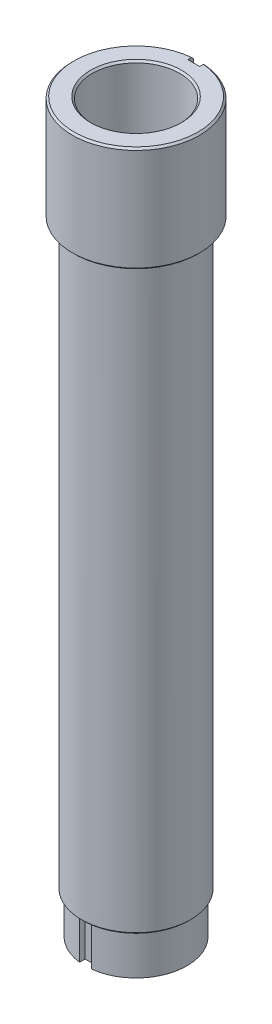
from build123d import *

# Parameters (mm, degrees)
SKETCH2_W           = 3.25
SKETCH2_H           = 3.25
CUT_EXTRUDE1_DEPTH  = 11
CHAMFER1_SIZE       = 0.5
SKETCH3_R           = 17.5
SKETCH3_R_2         = 15
BOSS_EXTRUDE1_DEPTH = 29
SKETCH4_W           = 3.25
SKETCH4_H           = 3.25
CUT_EXTRUDE2_DEPTH  = 29
CHAMFER2_SIZE       = 0.5


with BuildPart() as part:
    # Sketch1 → Revolve1 (revolve)
    with BuildSketch(Plane.XY, mode=Mode.PRIVATE) as revolve1_sk:
        Polygon((12, 200), (12, 0), (14, 0), (14, 11), (15, 11), (15, 200), align=None)
    revolve(revolve1_sk.sketch.rotate(Axis((0, 0, 0), (0, 1, 0)), 90), axis=Axis((0, 0, 0), (0, 1, 0)))

    # Sketch2 → Cut-Extrude1 (cut)
    with BuildSketch(Plane.XZ):
        with Locations((0, 14)):
            Rectangle(SKETCH2_W, SKETCH2_H)
    extrude(amount=-CUT_EXTRUDE1_DEPTH, mode=Mode.SUBTRACT)

    # Chamfer1
    chamfer1_edges = [part.edges().sort_by_distance(p)[0] for p in [
        (0, 11, 15),
    ]]
    chamfer(chamfer1_edges, length=CHAMFER1_SIZE)

    # Sketch3 → Boss-Extrude1 (add)
    with BuildSketch(Plane(origin=(0, 200, 0), x_dir=(1, 0, 0), z_dir=(0, 1, 0))):
        with Locations(Location((0, 0, 0), (0, 0, 270))):
            Circle(SKETCH3_R)
        with Locations(Location((0, 0, 0), (0, 0, 90))):
            Circle(SKETCH3_R_2, mode=Mode.SUBTRACT)
    extrude(amount=-BOSS_EXTRUDE1_DEPTH)

    # Sketch4 → Cut-Extrude2 (cut)
    with BuildSketch(Plane(origin=(0, 200, 0), x_dir=(1, 0, 0), z_dir=(0, 1, 0))):
        with Locations((0, 17.5)):
            Rectangle(SKETCH4_W, SKETCH4_H)
    extrude(amount=-CUT_EXTRUDE2_DEPTH, mode=Mode.SUBTRACT)

    # Chamfer2
    chamfer2_edges = [part.edges().sort_by_distance(p)[0] for p in [
        (0, 171, 15),
        (-17.481087339, 171, 0.813379038),
        (-17.481087339, 200, 0.813379038),
        (0, 200, 12),
    ]]
    chamfer(chamfer2_edges, length=CHAMFER2_SIZE)


solid = part.part
